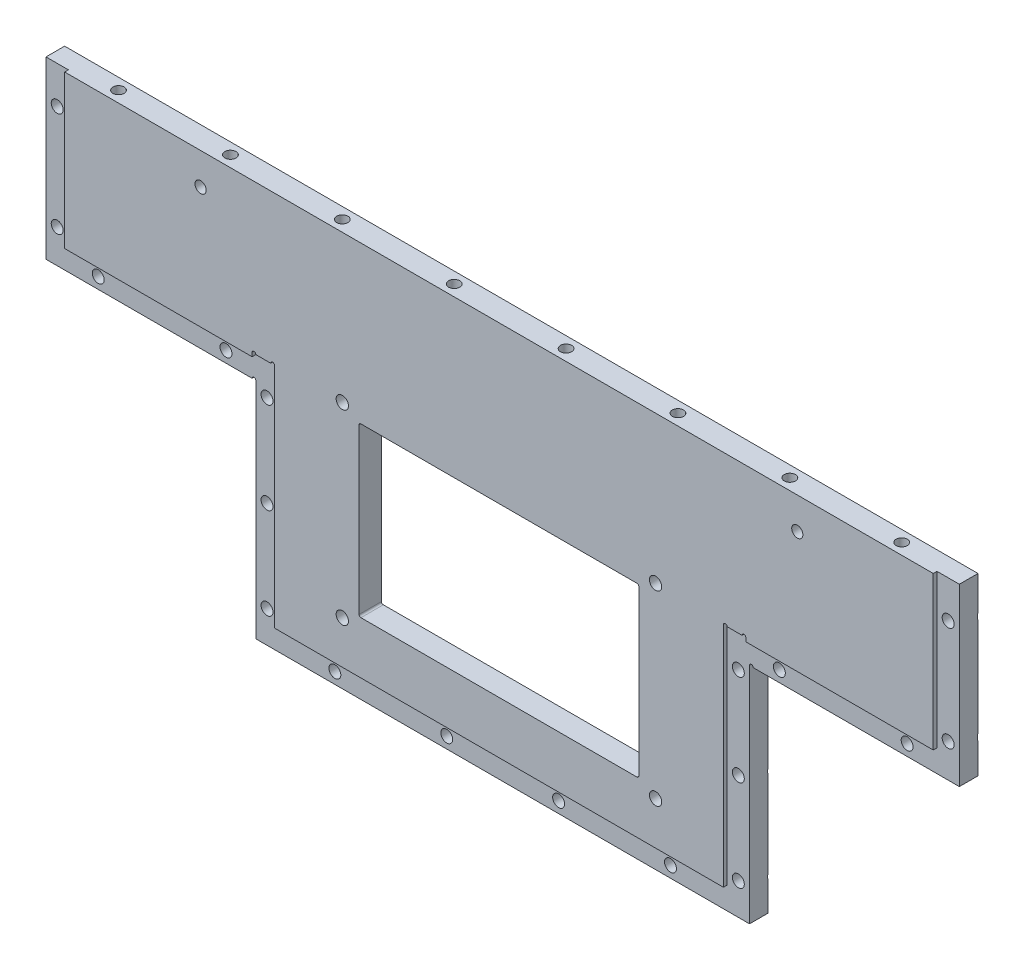
from build123d import *

# Parameters (mm, degrees)
EXTRUDE_1_DEPTH              = 3
CUT_EXTRUDE_START            = 3
CUT_EXTRUDE_2_DEPTH          = 1
CUT_EXTRUDE_3_DEPTH          = 136.739649697
CUT_EXTRUDE_3_DEPTH_BACK     = 136.739649697
HOLE_WIZARD_M3_1_D           = 3.2
HOLE_WIZARD_M3_1_CSINK_D     = 6.3
HOLE_WIZARD_M3_1_CSINK_ANGLE = 90
M4X0_7_1_D                   = 3.3
M3X0_5_1_D                   = 3
PATTERN_LINEAR_1_COUNT       = 8
PATTERN_LINEAR_1_PITCH       = 30


with BuildPart() as part:
    # ｽｹｯﾁ1 → ﾎﾞｽ - 押し出し1 (new, symmetric)
    with BuildSketch(Plane.XY):
        with BuildLine():
            Line((-122.45, 58.5), (122.45, 58.5))
            Line((122.45, 58.5), (122.45, 11.5))
            Line((122.45, 11.5), (67.187698744, 11.5))
            ThreePointArc((67.187698744, 11.5), (66.687698744, 12), (66.187698744, 11.5))
            Line((66.187698744, 11.5), (66.187698744, -48.5))
            Line((66.187698744, -48.5), (-66.187698744, -48.5))
            Line((-66.187698744, -48.5), (-66.187698744, 11.5))
            ThreePointArc((-66.187698744, 11.5), (-66.687698744, 12), (-67.187698744, 11.5))
            Line((-67.187698744, 11.5), (-122.45, 11.5))
            Line((-122.45, 11.5), (-122.45, 58.5))
        make_face()
    extrude(amount=EXTRUDE_1_DEPTH, both=True)

    # ｽｹｯﾁ1<4> → ｶｯﾄ - 押し出し2 (cut)
    with BuildSketch(Plane.XY.offset(CUT_EXTRUDE_START)):
        with BuildLine():
            Line((-116.45, 58.5), (-122.45, 58.5))
            Line((-122.45, 58.5), (-122.45, 11.5))
            Line((-122.45, 11.5), (-67.187698744, 11.5))
            ThreePointArc((-67.187698744, 11.5), (-66.687698744, 12), (-66.187698744, 11.5))
            Line((-66.187698744, 11.5), (-66.187698744, -48.5))
            Line((-66.187698744, -48.5), (66.187698744, -48.5))
            Line((66.187698744, -48.5), (66.187698744, 11.5))
            ThreePointArc((66.187698744, 11.5), (66.687698744, 12), (67.187698744, 11.5))
            Line((67.187698744, 11.5), (122.45, 11.5))
            Line((122.45, 11.5), (122.45, 58.5))
            Line((122.45, 58.5), (116.45, 58.5))
            Line((116.45, 58.5), (116.45, 17.5))
            Line((116.45, 17.5), (66.187698744, 17.5))
            Line((66.187698744, 17.5), (66.187698744, 18.5))
            ThreePointArc((66.187698744, 18.5), (65.687698744, 19), (65.187698744, 18.5))
            Line((65.187698744, 18.5), (61.187698744, 18.5))
            ThreePointArc((61.187698744, 18.5), (60.687698744, 19), (60.187698744, 18.5))
            Line((60.187698744, 18.5), (60.187698744, -42.5))
            Line((60.187698744, -42.5), (-60.187698744, -42.5))
            Line((-60.187698744, -42.5), (-60.187698744, 18.5))
            ThreePointArc((-60.187698744, 18.5), (-60.687698744, 19), (-61.187698744, 18.5))
            Line((-61.187698744, 18.5), (-65.187698744, 18.5))
            ThreePointArc((-65.187698744, 18.5), (-65.687698744, 19), (-66.187698744, 18.5))
            Line((-66.187698744, 18.5), (-66.187698744, 17.5))
            Line((-66.187698744, 17.5), (-116.45, 17.5))
            Line((-116.45, 17.5), (-116.45, 58.5))
        make_face()
    extrude(amount=-CUT_EXTRUDE_2_DEPTH, mode=Mode.SUBTRACT)

    # ｽｹｯﾁ1<5> → ｶｯﾄ - 押し出し3 (cut, two sides: drawn at the far end of the back side and taken through both)
    with BuildSketch(Plane.XY.offset(-CUT_EXTRUDE_3_DEPTH_BACK)):
        with BuildLine():
            Line((-37, 16.5), (37, 16.5))
            ThreePointArc((37, 16.5), (37.353553391, 16.353553391), (37.5, 16))
            Line((37.5, 16), (37.5, -28))
            ThreePointArc((37.5, -28), (37.353553391, -28.353553391), (37, -28.5))
            Line((37, -28.5), (-37, -28.5))
            ThreePointArc((-37, -28.5), (-37.353553391, -28.353553391), (-37.5, -28))
            Line((-37.5, -28), (-37.5, 16))
            ThreePointArc((-37.5, 16), (-37.353553391, 16.353553391), (-37, 16.5))
        make_face()
    extrude(amount=CUT_EXTRUDE_3_DEPTH + CUT_EXTRUDE_3_DEPTH_BACK, mode=Mode.SUBTRACT)

    # M3 丸皿ねじ用皿穴1 (through all)
    with Locations(Plane(origin=(119.45, 48.5, -3), x_dir=(-1, 0, 0), z_dir=(0, 0, -1))):
        with Locations((0, 0), (0, -28), (11, -34), (45.262301256, -34), (56.262301256, -39.5), (56.262301256, -64), (56.262301256, -88.5), (74.45, -94), (104.45, -94), (134.45, -94), (164.45, -94), (182.637698744, -88.5), (182.637698744, -64), (182.637698744, -39.5), (193.637698744, -34), (227.9, -34), (238.9, -28), (238.9, 0)):
            CounterSinkHole(HOLE_WIZARD_M3_1_D / 2, HOLE_WIZARD_M3_1_CSINK_D / 2, counter_sink_angle=HOLE_WIZARD_M3_1_CSINK_ANGLE)

    # ｽｹｯﾁ4 → M3x0.5 ねじ穴2 (revolve, cut)
    with BuildSketch(Plane(origin=(-105, 58.5, 0), x_dir=(0, 0, 1), z_dir=(1, 0, 0))):
        Polygon((0, 0), (0, 9.251075774), (1.25, 8.5), (1.25, 6), (1.5, 6), (1.5, 0), align=None)
    m3x0_5_2 = revolve(axis=Axis((-105, 64.85, 0), (0, -1, 0)), mode=Mode.SUBTRACT)

    # M4x0.7 ねじ穴1 (through all)
    with Locations(Plane(origin=(42, 19, -3), x_dir=(-1, 0, 0), z_dir=(0, 0, -1))):
        with Locations((0, 0), (84, 0), (84, -50), (0, -50)):
            Hole(M4X0_7_1_D / 2)

    # M3x0.5 ねじ穴1 (through all)
    with Locations(Plane(origin=(-80, 50, 3), x_dir=(1, 0, 0), z_dir=(0, 0, 1))):
        with Locations((0, 0), (160, 0)):
            Hole(M3X0_5_1_D / 2)

    # 直線ﾊﾟﾀｰﾝ1: M3x0.5 ねじ穴2 ×8
    with Locations(*[(i * PATTERN_LINEAR_1_PITCH, 0, 0) for i in range(1, PATTERN_LINEAR_1_COUNT)]):
        add(m3x0_5_2, mode=Mode.SUBTRACT)


solid = part.part
